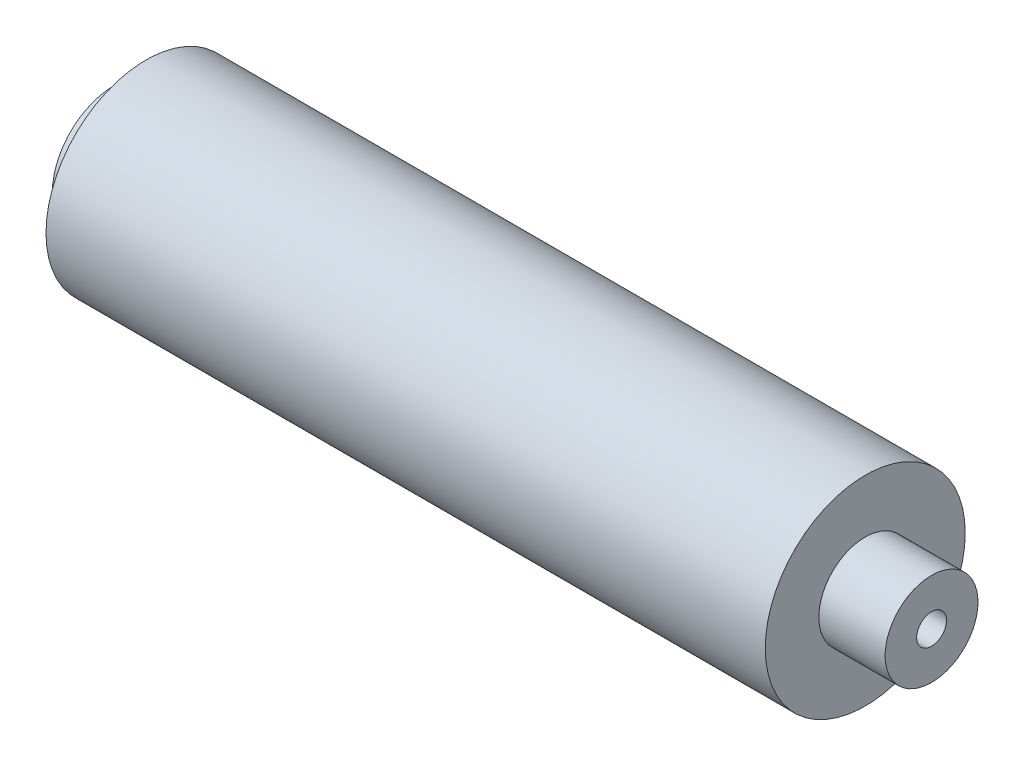
from build123d import *
from build123d.topology import SkipClean

# Parameters (mm, degrees)
SKETCH1_R           = 15.07617
BOSS_EXTRUDE1_DEPTH = 118.4446395
SKETCH2_R           = 9.3853
SKETCH2_R_2         = 4.5847
BOSS_EXTRUDE2_DEPTH = 4.7498
CUT_EXTRUDE1_DEPTH  = 26
SKETCH4_R           = 2.25
CUT_EXTRUDE2_DEPTH  = 2.6
CUT_EXTRUDE3_START  = -10
SKETCH5_R           = 15.07617
SKETCH5_R_2         = 7
CUT_EXTRUDE3_DEPTH  = 10


with BuildPart() as part:
    # Sketch1 → Boss-Extrude1 (new body)
    with BuildSketch(Plane(origin=(0, 0, 0), x_dir=(0, 0, -1), z_dir=(1, 0, 0))):
        with Locations(Location((0, 0, 0), (0, 0, 180))):
            Circle(SKETCH1_R)
    extrude(amount=BOSS_EXTRUDE1_DEPTH)

    # Sketch2 → Boss-Extrude2 (add)
    with BuildSketch(Plane.ZY):
        with Locations(Location((0, 0, 0), (0, 0, 180))):
            Circle(SKETCH2_R)
        Circle(SKETCH2_R_2, mode=Mode.SUBTRACT)
    extrude(amount=BOSS_EXTRUDE2_DEPTH)

    # Sketch3 → Cut-Extrude1 (cut)
    with BuildSketch(Plane(origin=(118.4446395, 0, 0), x_dir=(0, 0, -1), z_dir=(1, 0, 0))):
        with BuildLine():
            Line((-1.870828693, 1.25), (1.870828693, 1.25))
            ThreePointArc((1.870828693, 1.25), (0, -2.25), (-1.870828693, 1.25))
        make_face()
    extrude(amount=-CUT_EXTRUDE1_DEPTH, mode=Mode.SUBTRACT)

    # Sketch4 → Cut-Extrude2 (cut)
    with SkipClean():  # the faces are left unmerged after this step: merging them gives an invalid solid
        with BuildSketch(Plane(origin=(118.4446395, 0, 0), x_dir=(0, 0, -1), z_dir=(1, 0, 0))):
            Circle(SKETCH4_R)
        extrude(amount=-CUT_EXTRUDE2_DEPTH, mode=Mode.SUBTRACT)

    # Sketch5 → Cut-Extrude3 (cut)
    with SkipClean():  # the faces are left unmerged after this step: merging them gives an invalid solid
        with BuildSketch(Plane(origin=(118.4446395, 0, 0), x_dir=(0, 0, -1), z_dir=(1, 0, 0)).offset(CUT_EXTRUDE3_START)):
            with Locations(Location((0, 0, 0), (0, 0, 180))):
                Circle(SKETCH5_R)
            Circle(SKETCH5_R_2, mode=Mode.SUBTRACT)
        extrude(amount=CUT_EXTRUDE3_DEPTH, mode=Mode.SUBTRACT)


solid = part.part
